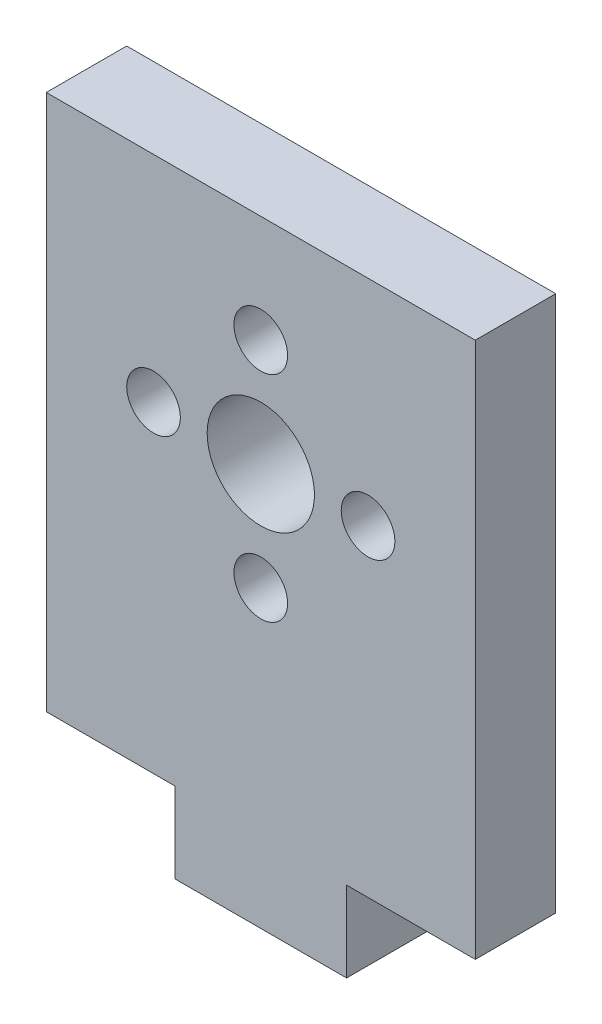
from build123d import *

# Parameters (mm, degrees)
SKETCH1_R           = 3.175
SKETCH1_R_2         = 1.5875
BOSS_EXTRUDE1_DEPTH = 4.7625


with BuildPart() as part:
    # Sketch1 → Boss-Extrude1 (new body)
    with BuildSketch(Plane.XY):
        Polygon((25.4, 0), (25.4, 31.75), (0, 31.75), (0, 0), (7.62, 0), (7.62, -4.7625), (17.78, -4.7625), (17.78, 0), align=None)
        with Locations(Location((12.7, 19.05, 0), (0, 0, 180))):
            Circle(SKETCH1_R, mode=Mode.SUBTRACT)
        with Locations(Location((12.7, 25.4, 0), (0, 0, 180))):
            Circle(SKETCH1_R_2, mode=Mode.SUBTRACT)
        with Locations(Location((19.05, 19.05, 0), (0, 0, 180))):
            Circle(SKETCH1_R_2, mode=Mode.SUBTRACT)
        with Locations(Location((6.35, 19.05, 0), (0, 0, 180))):
            Circle(SKETCH1_R_2, mode=Mode.SUBTRACT)
        with Locations(Location((12.7, 12.7, 0), (0, 0, 180))):
            Circle(SKETCH1_R_2, mode=Mode.SUBTRACT)
    extrude(amount=BOSS_EXTRUDE1_DEPTH)


solid = part.part
